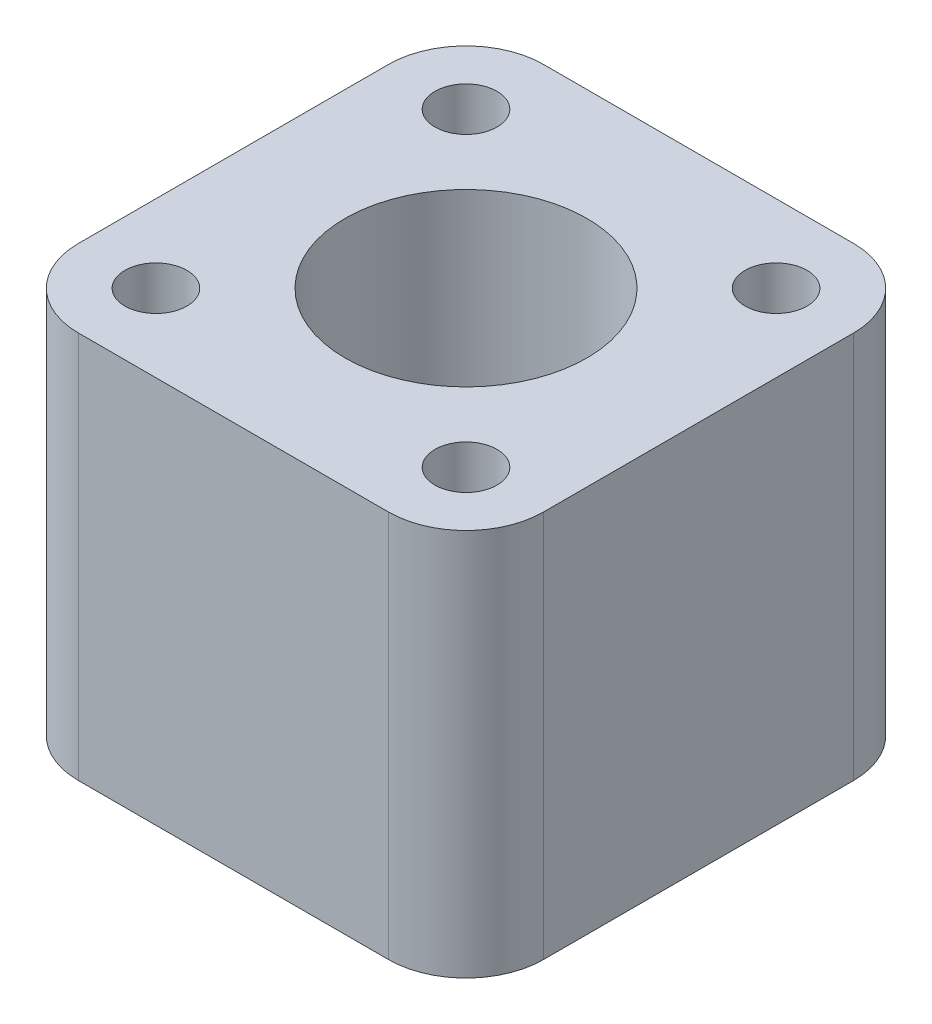
from build123d import *

# Parameters (mm, degrees)
SKETCH1_W           = 19.05
SKETCH1_H           = 19.05
SKETCH1_R           = 1.27
SKETCH1_R_2         = 3.96875
BOSS_EXTRUDE1_DEPTH = 15.875
FILLET2_R           = 3.175
SKETCH3_R           = 4.953
CUT_EXTRUDE1_DEPTH  = 9.525


with BuildPart() as part:
    # Sketch1 → Boss-Extrude1 (new body)
    with BuildSketch(Plane(origin=(0, 0, 0), x_dir=(1, 0, 0), z_dir=(0, 1, 0))):
        Rectangle(SKETCH1_W, SKETCH1_H)
        with Locations(Location((-6.35, 6.35, 0), (0, 0, 270))):
            Circle(SKETCH1_R, mode=Mode.SUBTRACT)
        with Locations(Location((6.35, 6.35, 0), (0, 0, 270))):
            Circle(SKETCH1_R, mode=Mode.SUBTRACT)
        with Locations(Location((6.35, -6.35, 0), (0, 0, 270))):
            Circle(SKETCH1_R, mode=Mode.SUBTRACT)
        with Locations(Location((-6.35, -6.35, 0), (0, 0, 270))):
            Circle(SKETCH1_R, mode=Mode.SUBTRACT)
        with Locations(Location((0, 0, 0), (0, 0, 270))):
            Circle(SKETCH1_R_2, mode=Mode.SUBTRACT)
    extrude(amount=BOSS_EXTRUDE1_DEPTH)

    # Fillet2
    fillet2_edges = [part.edges().sort_by_distance(p)[0] for p in [
        (9.525, 7.9375, 9.525),
        (-9.525, 7.9375, 9.525),
        (-9.525, 7.9375, -9.525),
        (9.525, 7.9375, -9.525),
    ]]
    fillet(fillet2_edges, radius=FILLET2_R)

    # Sketch3 → Cut-Extrude1 (cut)
    with BuildSketch(Plane(origin=(0, 15.875, 0), x_dir=(1, 0, 0), z_dir=(0, 1, 0))):
        with Locations(Location((0, 0, 0), (0, 0, 270))):
            Circle(SKETCH3_R)
    extrude(amount=-CUT_EXTRUDE1_DEPTH, mode=Mode.SUBTRACT)


solid = part.part
